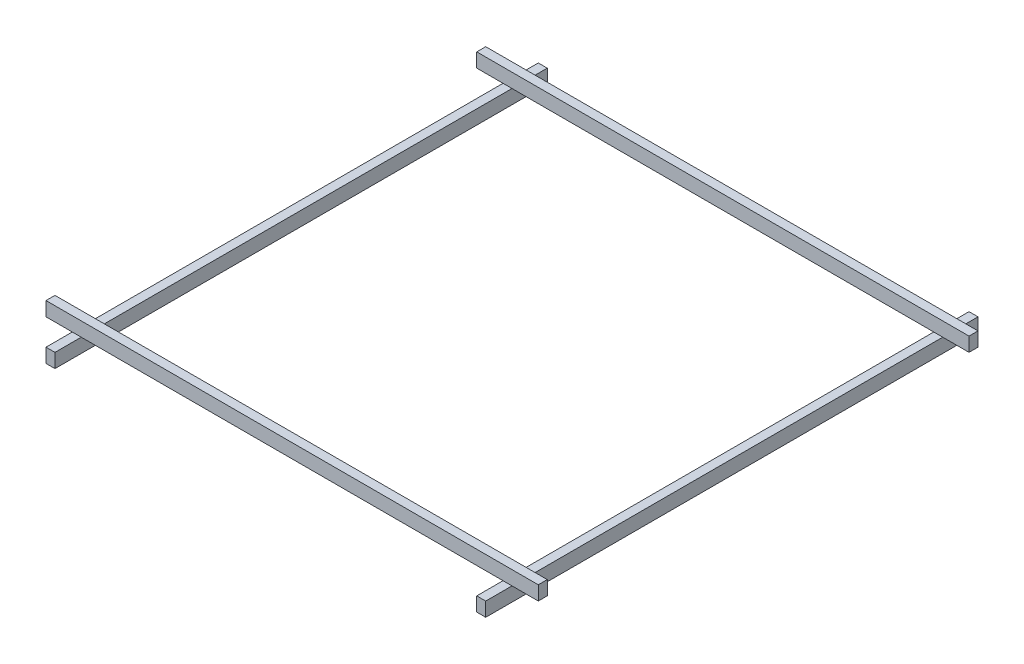
from build123d import *

# Parameters (mm, degrees)
SKETCH1_W              = 88.9
SKETCH1_H              = 139.7
PROFILES_4X6_1_DEPTH   = 4876.8
SKETCH1_ON_SEGMENT_2_W = 88.9
SKETCH1_ON_SEGMENT_2_H = 139.7
PROFILES_4X6_1_2_DEPTH = 4876.8
SKETCH1_ON_SEGMENT_3_W = 88.9
SKETCH1_ON_SEGMENT_3_H = 139.7
PROFILES_4X6_1_3_DEPTH = 4876.8
SKETCH1_ON_SEGMENT_4_W = 88.9
SKETCH1_ON_SEGMENT_4_H = 139.7
PROFILES_4X6_1_4_DEPTH = 4876.8


with BuildPart() as part:
    # Sketch1 → Profiles 4X6(1) (new body)
    with BuildSketch(Plane(origin=(0, 0, 0), x_dir=(-1, 0, 0), z_dir=(0, 0, -1))):
        Rectangle(SKETCH1_W, SKETCH1_H)
    extrude(amount=PROFILES_4X6_1_DEPTH)


with BuildPart() as body_2:
    # Sketch1 on segment 2 (carried to segment 2) → Profiles 4X6_1 2 (new body)
    with BuildSketch(Plane(origin=(4267.2, 0, 0), x_dir=(-1, 0, 0), z_dir=(0, 0, -1))):
        Rectangle(SKETCH1_ON_SEGMENT_2_W, SKETCH1_ON_SEGMENT_2_H)
    extrude(amount=PROFILES_4X6_1_2_DEPTH)


with BuildPart() as body_3:
    # Sketch1 on segment 3 (carried to segment 3) → Profiles 4X6_1 3 (new body)
    with BuildSketch(Plane(origin=(-304.8, 139.7, -4572), x_dir=(0, 0, -1), z_dir=(1, 0, 0))):
        Rectangle(SKETCH1_ON_SEGMENT_3_W, SKETCH1_ON_SEGMENT_3_H)
    extrude(amount=PROFILES_4X6_1_3_DEPTH)


with BuildPart() as body_4:
    # Sketch1 on segment 4 (carried to segment 4) → Profiles 4X6_1 4 (new body)
    with BuildSketch(Plane(origin=(4572, 139.7, -304.8), x_dir=(0, 0, 1), z_dir=(-1, 0, 0))):
        Rectangle(SKETCH1_ON_SEGMENT_4_W, SKETCH1_ON_SEGMENT_4_H)
    extrude(amount=PROFILES_4X6_1_4_DEPTH)


solid = Compound([part.part, body_2.part, body_3.part, body_4.part])
